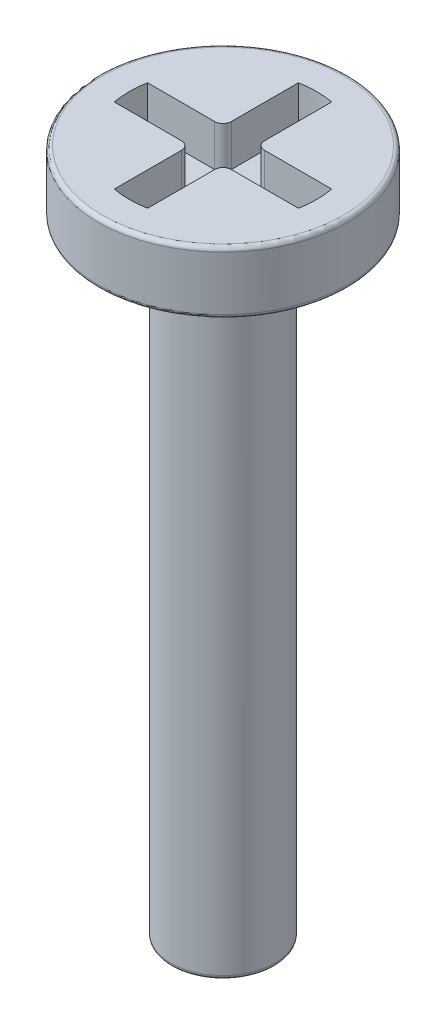
from build123d import *

# Parameters (mm, degrees)
FILLET1_R          = 0.1
CUT_EXTRUDE1_DEPTH = 1


with BuildPart() as part:
    # Sketch1 → Revolve1 (revolve)
    with BuildSketch(Plane.XY, mode=Mode.PRIVATE) as revolve1_sk:
        Polygon((0, 0), (-3, 0), (-3, -1.5), (-1.25, -1.5), (-1.25, -16.5), (0, -16.5), align=None)
    revolve(revolve1_sk.sketch.rotate(Axis((0, 14.912855268, 0), (0, -1, 0)), 270), axis=Axis((0, 14.912855268, 0), (0, -1, 0)))

    # Fillet1
    fillet1_edges = [part.edges().sort_by_distance(p)[0] for p in [
        (0, -16.5, -1.25),
        (0, -1.5, -3),
        (0, 0, -3),
    ]]
    fillet(fillet1_edges, radius=FILLET1_R)

    # Sketch2 → Cut-Extrude1 (cut)
    with BuildSketch(Plane(origin=(0, 0, 0), x_dir=(1, 0, 0), z_dir=(0, 1, 0))):
        with BuildLine():
            Line((-2.214158983, -0.4), (-0.6, -0.4))
            ThreePointArc((-0.6, -0.4), (-0.458578644, -0.458578644), (-0.4, -0.6))
            Line((-0.4, -0.6), (-0.4, -2.214158983))
            ThreePointArc((-0.4, -2.214158983), (0, -2.25), (0.4, -2.214158983))
            Line((0.4, -2.214158983), (0.4, -0.6))
            ThreePointArc((0.4, -0.6), (0.458578644, -0.458578644), (0.6, -0.4))
            Line((0.6, -0.4), (2.214158983, -0.4))
            ThreePointArc((2.214158983, -0.4), (2.25, 0), (2.214158983, 0.4))
            Line((2.214158983, 0.4), (0.6, 0.4))
            ThreePointArc((0.6, 0.4), (0.458578644, 0.458578644), (0.4, 0.6))
            Line((0.4, 0.6), (0.4, 2.214158983))
            ThreePointArc((0.4, 2.214158983), (0, 2.25), (-0.4, 2.214158983))
            Line((-0.4, 2.214158983), (-0.4, 0.6))
            ThreePointArc((-0.4, 0.6), (-0.458578644, 0.458578644), (-0.6, 0.4))
            Line((-0.6, 0.4), (-2.214158983, 0.4))
            ThreePointArc((-2.214158983, 0.4), (-2.25, 0), (-2.214158983, -0.4))
        make_face()
    extrude(amount=-CUT_EXTRUDE1_DEPTH, mode=Mode.SUBTRACT)


solid = part.part
